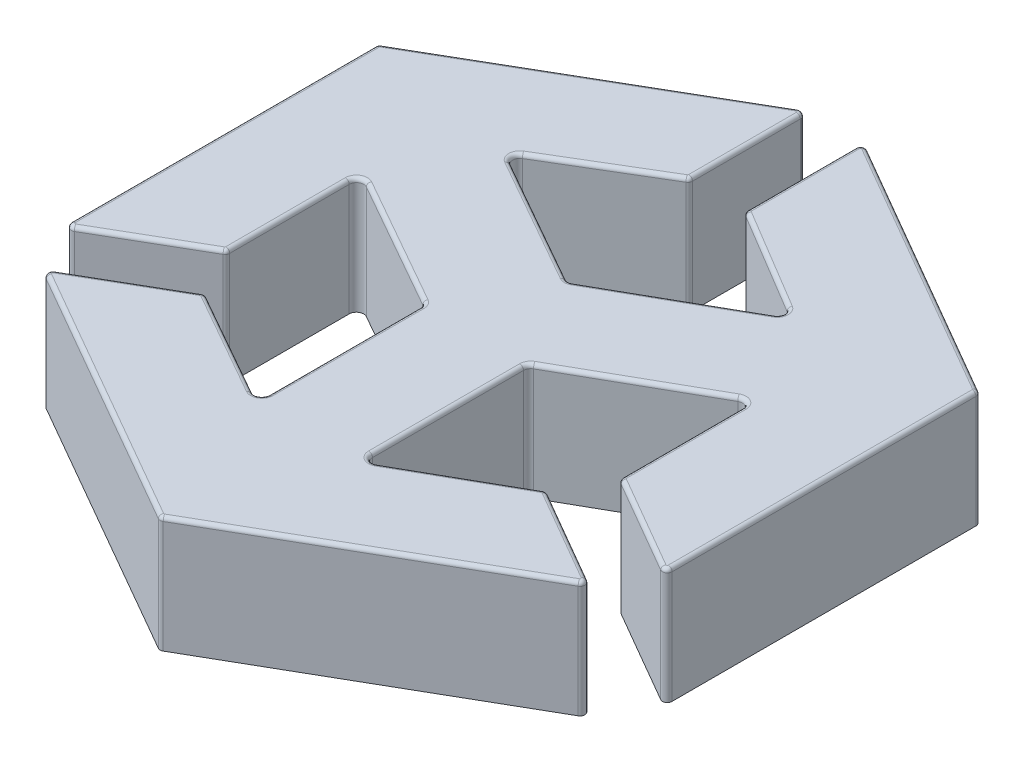
from build123d import *

# Parameters (mm, degrees)
BOSS_EXTRUDE1_DEPTH = 12
FILLET1_R           = 0.4


with BuildPart() as part:
    # Sketch2 → Boss-Extrude1 (new body)
    with BuildSketch(Plane(origin=(0, 0, 0), x_dir=(1, 0, 0), z_dir=(0, 1, 0))):
        with BuildLine():
            Line((30.685392159, 42.367399762), (17.394899403, 49.906124645))
            ThreePointArc((17.394899403, 49.906124645), (17.014988006, 50.549604576), (17.379556544, 51.201899657))
            Line((17.379556544, 51.201899657), (27.955799295, 57.536628388))
            ThreePointArc((27.955799295, 57.536628388), (28.133885568, 57.719055755), (28.198880034, 57.96557185))
            Line((28.198880034, 57.96557185), (28.198880034, 69.110408185))
            ThreePointArc((28.198880034, 69.110408185), (27.948584386, 69.543591445), (27.448289088, 69.543079166))
            Line((27.448289088, 69.543079166), (0.249409054, 53.790247635))
            ThreePointArc((0.249409054, 53.790247635), (0.06681674, 53.607281006), (0, 53.357576654))
            Line((0, 53.357576654), (0, 21.946144977))
            ThreePointArc((0, 21.946144977), (0.250295648, 21.512961717), (0.750590946, 21.513473996))
            Line((0.750590946, 21.513473996), (10.485126092, 27.151444824))
            ThreePointArc((10.485126092, 27.151444824), (10.667718406, 27.334411453), (10.734535146, 27.584115805))
            Line((10.734535146, 27.584115805), (10.734535146, 39.938347903))
            ThreePointArc((10.734535146, 39.938347903), (11.107061322, 40.586432398), (11.854571179, 40.590707723))
            Line((11.854571179, 40.590707723), (25.329101543, 32.94759176))
            ThreePointArc((25.329101543, 32.94759176), (25.607150005, 32.672705765), (25.70906551, 32.29523194))
            Line((25.70906551, 32.29523194), (25.70906551, 16.68056549))
            ThreePointArc((25.70906551, 16.68056549), (25.336539334, 16.032480996), (24.589029478, 16.02820567))
            Line((24.589029478, 16.02820567), (13.662855507, 22.22582536))
            ThreePointArc((13.662855507, 22.22582536), (13.413917055, 22.29091376), (13.165573873, 22.223589794))
            Line((13.165573873, 22.223589794), (3.560555046, 16.6606312))
            ThreePointArc((3.560555046, 16.6606312), (3.311146766, 16.227080269), (3.562079511, 15.79440989))
            Line((3.562079511, 15.79440989), (30.80636171, 0.143083992))
            ThreePointArc((30.80636171, 0.143083992), (31.055428191, 0.076634322), (31.304494672, 0.143083992))
            Line((31.304494672, 0.143083992), (58.548776872, 15.79440989))
            ThreePointArc((58.548776872, 15.79440989), (58.799709616, 16.227080269), (58.550301337, 16.6606312))
            Line((58.550301337, 16.6606312), (48.94528251, 22.223589794))
            ThreePointArc((48.94528251, 22.223589794), (48.696939328, 22.29091376), (48.448000876, 22.22582536))
            Line((48.448000876, 22.22582536), (37.521826905, 16.02820567))
            ThreePointArc((37.521826905, 16.02820567), (36.774317049, 16.032480996), (36.401790873, 16.68056549))
            Line((36.401790873, 16.68056549), (36.401790873, 32.29523194))
            ThreePointArc((36.401790873, 32.29523194), (36.503706378, 32.672705765), (36.78175484, 32.94759176))
            Line((36.78175484, 32.94759176), (50.256285204, 40.590707723))
            ThreePointArc((50.256285204, 40.590707723), (51.003795061, 40.586432398), (51.376321236, 39.938347903))
            Line((51.376321236, 39.938347903), (51.376321236, 27.584115805))
            ThreePointArc((51.376321236, 27.584115805), (51.443137977, 27.334411453), (51.625730291, 27.151444824))
            Line((51.625730291, 27.151444824), (61.360265437, 21.513473996))
            ThreePointArc((61.360265437, 21.513473996), (61.860560735, 21.512961717), (62.110856383, 21.946144977))
            Line((62.110856383, 21.946144977), (62.110856383, 53.357576654))
            ThreePointArc((62.110856383, 53.357576654), (62.044039643, 53.607281006), (61.861447329, 53.790247635))
            Line((61.861447329, 53.790247635), (34.662567295, 69.543079166))
            ThreePointArc((34.662567295, 69.543079166), (34.162271997, 69.543591445), (33.911976349, 69.110408185))
            Line((33.911976349, 69.110408185), (33.911976349, 57.96557185))
            ThreePointArc((33.911976349, 57.96557185), (33.976970814, 57.719055755), (34.155057088, 57.536628388))
            Line((34.155057088, 57.536628388), (44.731299839, 51.201899657))
            ThreePointArc((44.731299839, 51.201899657), (45.095868377, 50.549604576), (44.71595698, 49.906124645))
            Line((44.71595698, 49.906124645), (31.425464224, 42.367399762))
            ThreePointArc((31.425464224, 42.367399762), (31.055428191, 42.269759582), (30.685392159, 42.367399762))
        make_face()
    extrude(amount=BOSS_EXTRUDE1_DEPTH)

    # Fillet1
    fillet1_edges = [part.edges().sort_by_distance(p)[0] for p in [
        (31.055428191, 12, -0.076634322),
        (44.926635772, 12, -7.968746941),
        (58.799709616, 12, -16.227080269),
        (53.747791923, 12, -19.442110497),
        (48.696939328, 12, -22.29091376),
        (42.98491389, 12, -19.127015515),
        (36.774317049, 12, -16.032480996),
        (36.401790873, 12, -24.487898715),
        (17.014988006, 12, -50.549604576),
        (36.503706378, 12, -32.672705765),
        (43.519020022, 12, -36.769149742),
        (51.003795061, 12, -40.586432398),
        (51.376321236, 12, -33.761231854),
        (51.443137977, 12, -27.334411453),
        (56.492997864, 12, -24.33245941),
        (61.860560735, 12, -21.512961717),
        (62.110856383, 12, -37.651860815),
        (62.044039643, 12, -53.607281006),
        (48.262007312, 12, -61.666663401),
        (22.667677919, 12, -54.369264023),
        (34.162271997, 12, -69.543591445),
        (33.911976349, 12, -63.537990018),
        (33.976970814, 12, -57.719055755),
        (39.443178463, 12, -54.369264023),
        (45.095868377, 12, -50.549604576),
        (38.070710602, 12, -46.136762203),
        (28.133885568, 12, -57.719055755),
        (28.198880034, 12, -63.537990018),
        (27.948584386, 12, -69.543591445),
        (13.848849071, 12, -61.666663401),
        (0.06681674, 12, -53.607281006),
        (0, 12, -37.651860815),
        (0.250295648, 12, -21.512961717),
        (5.617858519, 12, -24.33245941),
        (31.055428191, 12, -42.269759582),
        (10.667718406, 12, -27.334411453),
        (10.734535146, 12, -33.761231854),
        (11.107061322, 12, -40.586432398),
        (18.591836361, 12, -36.769149742),
        (25.607150005, 12, -32.672705765),
        (25.70906551, 12, -24.487898715),
        (25.336539334, 12, -16.032480996),
        (19.125942492, 12, -19.127015515),
        (13.413917055, 12, -22.29091376),
        (8.36306446, 12, -19.442110497),
        (24.040145781, 12, -46.136762203),
        (3.311146766, 12, -16.227080269),
        (17.184220611, 12, -7.968746941),
    ]]
    fillet(fillet1_edges, radius=FILLET1_R)


solid = part.part
